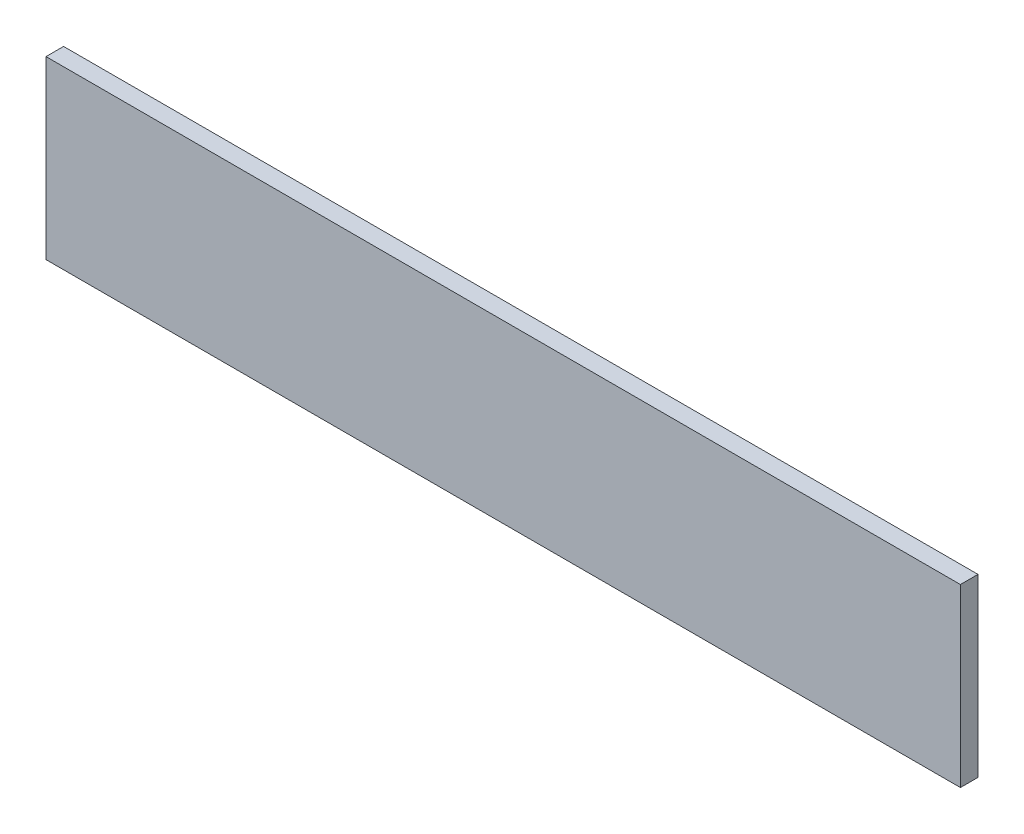
from build123d import *

# Parameters (mm, degrees)
ESQUISSE1_W        = 260
ESQUISSE1_H        = 50
BOSS_EXTRU_1_DEPTH = 5


with BuildPart() as part:
    # Esquisse1 → Boss.-Extru.1 (new body)
    with BuildSketch(Plane.XY):
        with Locations((130, -25)):
            Rectangle(ESQUISSE1_W, ESQUISSE1_H)
    extrude(amount=BOSS_EXTRU_1_DEPTH)


solid = part.part
